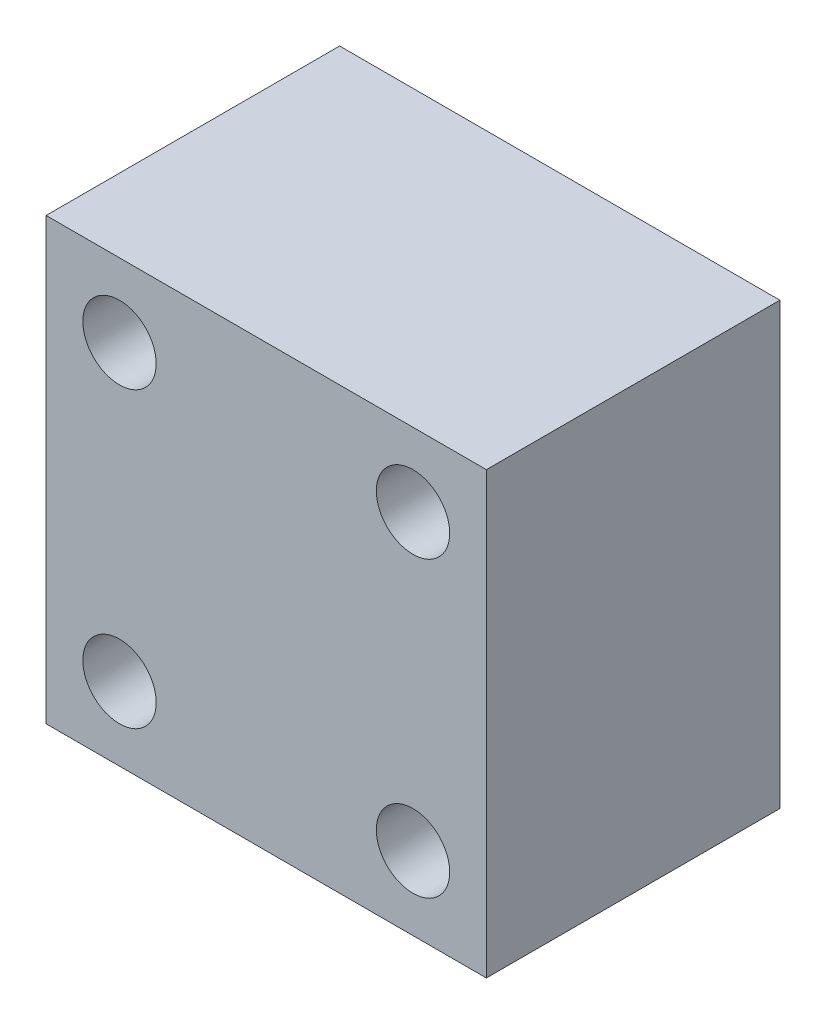
from build123d import *

# Parameters (mm, degrees)
SKETCH1_W           = 60
SKETCH1_H           = 60
BOSS_EXTRUDE1_DEPTH = 40
SKETCH2_R           = 5
CUT_EXTRUDE1_DEPTH  = 20


with BuildPart() as part:
    # Sketch1 → Boss-Extrude1 (new body)
    with BuildSketch(Plane.XY):
        with Locations((5.498007968, -7.64940239)):
            Rectangle(SKETCH1_W, SKETCH1_H)
    extrude(amount=BOSS_EXTRUDE1_DEPTH)

    # Sketch2 → Cut-Extrude1 (cut)
    with BuildSketch(Plane.XY.offset(40)):
        with Locations((-14.501992032, 12.35059761)):
            Circle(SKETCH2_R)
        with Locations((25.498007968, 12.35059761)):
            Circle(SKETCH2_R)
        with Locations((25.498007968, -27.64940239)):
            Circle(SKETCH2_R)
        with Locations((-14.501992032, -27.64940239)):
            Circle(SKETCH2_R)
    extrude(amount=-CUT_EXTRUDE1_DEPTH, mode=Mode.SUBTRACT)


solid = part.part
